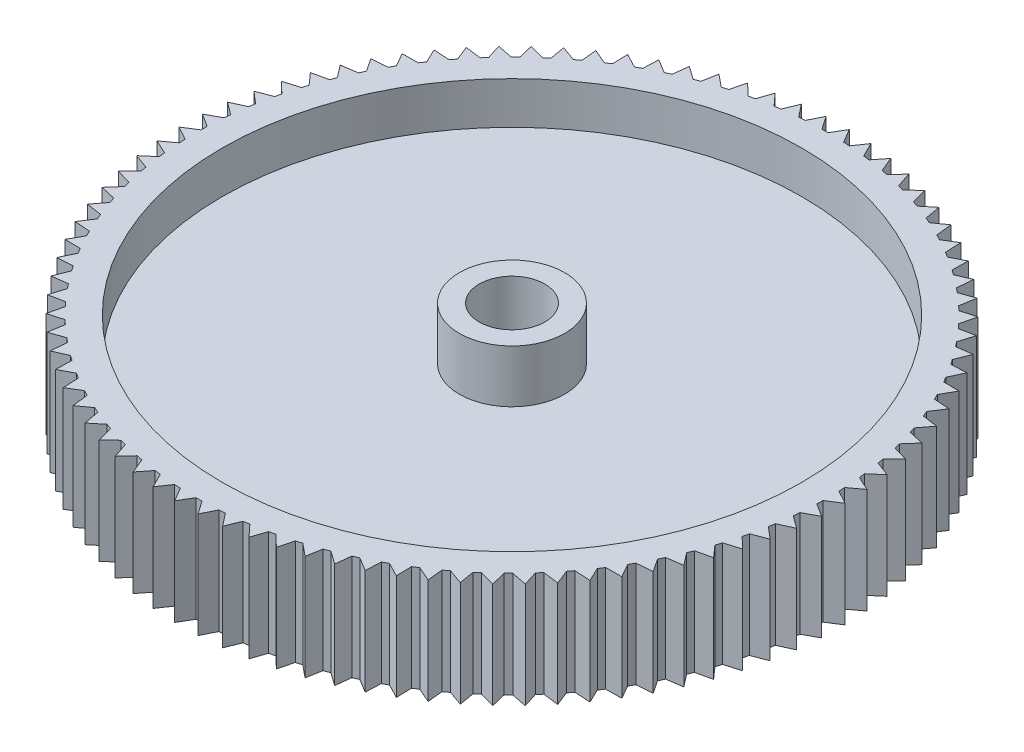
from build123d import *

# Parameters (mm, degrees)
SKETCH1_R           = 12.058419915
BOSS_EXTRUDE1_DEPTH = 10
SKETCH2_R           = 30
BOSS_EXTRUDE3_DEPTH = 5
SKETCH3_R           = 27.5
CUT_EXTRUDE1_DEPTH  = 4
CUT_EXTRUDE2_START  = -4
SKETCH4_R           = 27.5
CUT_EXTRUDE2_DEPTH  = 4
SKETCH5_R           = 5
BOSS_EXTRUDE4_DEPTH = 5
SKETCH6_R           = 3.120479068
CUT_EXTRUDE3_DEPTH  = 10
BOSS_EXTRUDE5_DEPTH = 10


with BuildPart() as part:
    # Sketch1 → Boss-Extrude1 (new body)
    with BuildSketch(Plane(origin=(0, 0, 0), x_dir=(1, 0, 0), z_dir=(0, 1, 0))):
        with Locations(Location((0, 0, 0), (0, 0, 270))):
            Circle(SKETCH1_R)
    extrude(amount=BOSS_EXTRUDE1_DEPTH)

    # Sketch2 → Boss-Extrude3 (add, symmetric)
    with BuildSketch(Plane(origin=(0, 5, 0), x_dir=(1, 0, 0), z_dir=(0, 1, 0))):
        with Locations(Location((0, 0, 0), (0, 0, 270))):
            Circle(SKETCH2_R)
    extrude(amount=BOSS_EXTRUDE3_DEPTH, both=True)

    # Sketch3 → Cut-Extrude1 (cut)
    with BuildSketch(Plane(origin=(0, 10, 0), x_dir=(1, 0, 0), z_dir=(0, 1, 0))):
        with Locations(Location((0, 0, 0), (0, 0, 270))):
            Circle(SKETCH3_R)
    extrude(amount=-CUT_EXTRUDE1_DEPTH, mode=Mode.SUBTRACT)

    # Sketch4 → Cut-Extrude2 (cut)
    with BuildSketch(Plane.XZ.offset(CUT_EXTRUDE2_START)):
        with Locations(Location((0, 0, 0), (0, 0, 90))):
            Circle(SKETCH4_R)
    extrude(amount=CUT_EXTRUDE2_DEPTH, mode=Mode.SUBTRACT)

    # Sketch5 → Boss-Extrude4 (add, symmetric)
    with BuildSketch(Plane(origin=(0, 6, 0), x_dir=(1, 0, 0), z_dir=(0, 1, 0))):
        with Locations(Location((0, 0, 0), (0, 0, 90))):
            Circle(SKETCH5_R)
    extrude(amount=BOSS_EXTRUDE4_DEPTH, both=True)

    # Sketch6 → Cut-Extrude3 (cut)
    with BuildSketch(Plane.XZ.offset(-1)):
        with Locations(Location((0, 0, 0), (0, 0, 270))):
            Circle(SKETCH6_R)
    extrude(amount=-CUT_EXTRUDE3_DEPTH, mode=Mode.SUBTRACT)

    # Sketch8 → Boss-Extrude5 (add)
    with BuildSketch(Plane(origin=(0, 10, 0), x_dir=(1, 0, 0), z_dir=(0, 1, 0))):
        Polygon((0, 30), (0.746596457, 31.270360567), (1.519609021, 29.961488421), align=None)
        Polygon((2.926087871, 31.142107605), (3.605915111, 29.782501175), (2.092694212, 29.926921508), align=None)
        Polygon((5.09132368, 30.862133424), (5.674653544, 29.458416576), (4.175193029, 29.708042062), align=None)
        Polygon((7.231755071, 30.431802031), (7.715745635, 28.990813533), (6.237350725, 29.344428022), align=None)
        Polygon((9.336954079, 29.853209958), (9.71924739, 28.38197016), (8.269120675, 28.837850878), align=None)
        Polygon((11.396664384, 29.129176047), (11.675397948, 27.634852682), (10.2606043, 28.190778624), align=None)
        Polygon((13.400851287, 28.263227719), (13.574667141, 26.753100979), (12.202099292, 27.406363729), align=None)
        Polygon((15.339750589, 27.259583785), (15.40780192, 25.741010858), (14.084146884, 26.488427786), align=None)
        Polygon((17.203916168, 26.1231339), (17.165871437, 24.603513119), (15.897577927, 25.441442885), align=None)
        Polygon((18.984265997, 24.859414733), (18.840310554, 23.346149538), (17.633557569, 24.270509831), align=None)
        Polygon((20.67212639, 23.474582995), (20.422961572, 21.975045862), (19.283628291, 22.981333294), align=None)
        Polygon((22.259274262, 21.975385449), (21.906113973, 20.496881972), (20.839751114, 21.58019401), align=None)
        Polygon((23.737977186, 20.369126034), (23.28254199, 18.918859334), (22.294344764, 20.073918191), align=None)
        Polygon((25.101031072, 18.663630284), (24.545539802, 17.248665914), (23.640322608, 18.46984426), align=None)
        Polygon((26.341795258, 16.867207204), (25.688954212, 15.494438728), (24.871127177, 16.775787104), align=None)
        Polygon((27.454224865, 14.988608786), (26.707214619, 13.664724194), (25.980762114, 15), align=None)
        Polygon((28.432900249, 13.036987372), (27.595360161, 11.768436498), (26.963821389, 13.151134404), align=None)
        Polygon((29.2730534, 11.021851066), (28.349063882, 9.814814161), (27.815515637, 11.238197802), align=None)
        Polygon((29.970591178, 8.95301741), (28.964653813, 7.813375037), (28.531695489, 9.270509831), align=None)
        Polygon((30.522115248, 6.840565553), (29.439130863, 5.773869935), (29.108871788, 7.257656868), align=None)
        Polygon((30.92493864, 4.694787148), (29.770183426, 3.706235119), (29.54423259, 5.20944533), align=None)
        Polygon((31.177098841, 2.526136213), (29.956198649, 1.620543898), (29.835656861, 3.135853898), align=None)
        Polygon((31.277367349, 0.345178195), (29.996270282, -0.47304245), (29.981724811, 1.046984901), align=None)
        Polygon((31.225255668, -1.837461496), (29.890203102, -2.564324183), (29.981724811, -1.046984901), align=None)
        Polygon((31.02101768, -4.011149259), (29.638513857, -4.643112786), (29.835656861, -3.135853898), align=None)
        Polygon((30.665648412, -6.165295107), (29.242428752, -6.69928061), (29.54423259, -5.20944533), align=None)
        Polygon((30.160879188, -8.289404256), (28.703877473, -8.722810213), (29.108871788, -7.257656868), align=None)
        Polygon((29.509169191, -10.373128261), (28.025483789, -10.703843161), (28.531695489, -9.270509831), align=None)
        Polygon((28.713693489, -12.406315428), (27.210552764, -12.632728061), (27.815515637, -11.238197802), align=None)
        Polygon((27.778327559, -14.379060273), (26.263054662, -14.50006758), (26.963821389, -13.151134404), align=None)
        Polygon((26.707628408, -16.281751782), (25.187605597, -16.296764227), (25.980762114, -15), align=None)
        Polygon((25.506812377, -18.105120233), (23.98944505, -18.014064677), (24.871127177, -16.775787104), align=None)
        Polygon((24.18172972, -19.840282358), (22.674410338, -19.643602415), (23.640322608, -18.46984426), align=None)
        Polygon((22.738836107, -21.478784621), (21.248908178, -21.177438496), (22.294344764, -20.073918191), align=None)
        Polygon((21.185161169, -23.012644405), (19.719883473, -22.608100225), (20.839751114, -21.58019401), align=None)
        Polygon((19.528274256, -24.434388899), (18.094785478, -23.928617563), (19.283628291, -22.981333294), align=None)
        Polygon((17.776247554, -25.737091506), (16.381531508, -25.132557082), (17.633557569, -24.270509831), align=None)
        Polygon((15.93761676, -26.91440559), (14.588468362, -26.214053308), (15.897577927, -25.441442885), align=None)
        Polygon((14.0213395, -27.960595396), (12.724331665, -27.167837302), (14.084146884, -26.488427786), align=None)
        Polygon((12.036751683, -28.870563992), (10.798203303, -27.989262324), (12.202099292, -27.406363729), align=None)
        Polygon((9.993522022, -29.639878102), (8.81946718, -28.674326473), (10.2606043, -28.190778624), align=None)
        Polygon((7.901604926, -30.264789705), (6.7977635, -29.219692185), (8.269120675, -28.837850878), align=None)
        Polygon((5.771192005, -30.742254295), (4.742941799, -29.622702495), (6.237350725, -29.344428022), align=None)
        Polygon((3.612662417, -31.069945712), (2.665012962, -29.881393975), (4.175193029, -29.708042062), align=None)
        Polygon((1.4365323, -31.246267477), (0.57410045, -29.994506308), (2.092694212, -29.926921508), align=None)
        Polygon((-0.746596457, -31.270360567), (-1.519609021, -29.961488421), (0, -30), align=None)
        Polygon((-2.926087871, -31.142107605), (-3.605915111, -29.782501175), (-2.092694212, -29.926921508), align=None)
        Polygon((-5.09132368, -30.862133424), (-5.674653544, -29.458416576), (-4.175193029, -29.708042062), align=None)
        Polygon((-7.231755071, -30.431802031), (-7.715745635, -28.990813533), (-6.237350725, -29.344428022), align=None)
        Polygon((-9.336954079, -29.853209958), (-9.71924739, -28.38197016), (-8.269120675, -28.837850878), align=None)
        Polygon((-11.396664384, -29.129176047), (-11.675397948, -27.634852682), (-10.2606043, -28.190778624), align=None)
        Polygon((-13.400851287, -28.263227719), (-13.574667141, -26.753100979), (-12.202099292, -27.406363729), align=None)
        Polygon((-15.339750589, -27.259583785), (-15.40780192, -25.741010858), (-14.084146884, -26.488427786), align=None)
        Polygon((-17.203916168, -26.1231339), (-17.165871437, -24.603513119), (-15.897577927, -25.441442885), align=None)
        Polygon((-18.984265997, -24.859414733), (-18.840310554, -23.346149538), (-17.633557569, -24.270509831), align=None)
        Polygon((-20.67212639, -23.474582995), (-20.422961572, -21.975045862), (-19.283628291, -22.981333294), align=None)
        Polygon((-22.259274262, -21.975385449), (-21.906113973, -20.496881972), (-20.839751114, -21.58019401), align=None)
        Polygon((-23.737977186, -20.369126034), (-23.28254199, -18.918859334), (-22.294344764, -20.073918191), align=None)
        Polygon((-25.101031072, -18.663630284), (-24.545539802, -17.248665914), (-23.640322608, -18.46984426), align=None)
        Polygon((-26.341795258, -16.867207204), (-25.688954212, -15.494438728), (-24.871127177, -16.775787104), align=None)
        Polygon((-27.454224865, -14.988608786), (-26.707214619, -13.664724194), (-25.980762114, -15), align=None)
        Polygon((-28.432900249, -13.036987372), (-27.595360161, -11.768436498), (-26.963821389, -13.151134404), align=None)
        Polygon((-29.2730534, -11.021851066), (-28.349063882, -9.814814161), (-27.815515637, -11.238197802), align=None)
        Polygon((-29.970591178, -8.95301741), (-28.964653813, -7.813375037), (-28.531695489, -9.270509831), align=None)
        Polygon((-30.522115248, -6.840565553), (-29.439130863, -5.773869935), (-29.108871788, -7.257656868), align=None)
        Polygon((-30.92493864, -4.694787148), (-29.770183426, -3.706235119), (-29.54423259, -5.20944533), align=None)
        Polygon((-31.177098841, -2.526136213), (-29.956198649, -1.620543898), (-29.835656861, -3.135853898), align=None)
        Polygon((-31.277367349, -0.345178195), (-29.996270282, 0.47304245), (-29.981724811, -1.046984901), align=None)
        Polygon((-31.225255668, 1.837461496), (-29.890203102, 2.564324183), (-29.981724811, 1.046984901), align=None)
        Polygon((-31.02101768, 4.011149259), (-29.638513857, 4.643112786), (-29.835656861, 3.135853898), align=None)
        Polygon((-30.665648412, 6.165295107), (-29.242428752, 6.69928061), (-29.54423259, 5.20944533), align=None)
        Polygon((-30.160879188, 8.289404256), (-28.703877473, 8.722810213), (-29.108871788, 7.257656868), align=None)
        Polygon((-29.509169191, 10.373128261), (-28.025483789, 10.703843161), (-28.531695489, 9.270509831), align=None)
        Polygon((-28.713693489, 12.406315428), (-27.210552764, 12.632728061), (-27.815515637, 11.238197802), align=None)
        Polygon((-27.778327559, 14.379060273), (-26.263054662, 14.50006758), (-26.963821389, 13.151134404), align=None)
        Polygon((-26.707628408, 16.281751782), (-25.187605597, 16.296764227), (-25.980762114, 15), align=None)
        Polygon((-25.506812377, 18.105120233), (-23.98944505, 18.014064677), (-24.871127177, 16.775787104), align=None)
        Polygon((-24.18172972, 19.840282358), (-22.674410338, 19.643602415), (-23.640322608, 18.46984426), align=None)
        Polygon((-22.738836107, 21.478784621), (-21.248908178, 21.177438496), (-22.294344764, 20.073918191), align=None)
        Polygon((-21.185161169, 23.012644405), (-19.719883473, 22.608100225), (-20.839751114, 21.58019401), align=None)
        Polygon((-19.528274256, 24.434388899), (-18.094785478, 23.928617563), (-19.283628291, 22.981333294), align=None)
        Polygon((-17.776247554, 25.737091506), (-16.381531508, 25.132557082), (-17.633557569, 24.270509831), align=None)
        Polygon((-15.93761676, 26.91440559), (-14.588468362, 26.214053308), (-15.897577927, 25.441442885), align=None)
        Polygon((-14.0213395, 27.960595396), (-12.724331665, 27.167837302), (-14.084146884, 26.488427786), align=None)
        Polygon((-12.036751683, 28.870563992), (-10.798203303, 27.989262324), (-12.202099292, 27.406363729), align=None)
        Polygon((-9.993522022, 29.639878102), (-8.81946718, 28.674326473), (-10.2606043, 28.190778624), align=None)
        Polygon((-7.901604926, 30.264789705), (-6.7977635, 29.219692185), (-8.269120675, 28.837850878), align=None)
        Polygon((-5.771192005, 30.742254295), (-4.742941799, 29.622702495), (-6.237350725, 29.344428022), align=None)
        Polygon((-3.612662417, 31.069945712), (-2.665012962, 29.881393975), (-4.175193029, 29.708042062), align=None)
        Polygon((-1.4365323, 31.246267477), (-0.57410045, 29.994506308), (-2.092694212, 29.926921508), align=None)
    extrude(amount=-BOSS_EXTRUDE5_DEPTH)


solid = part.part
